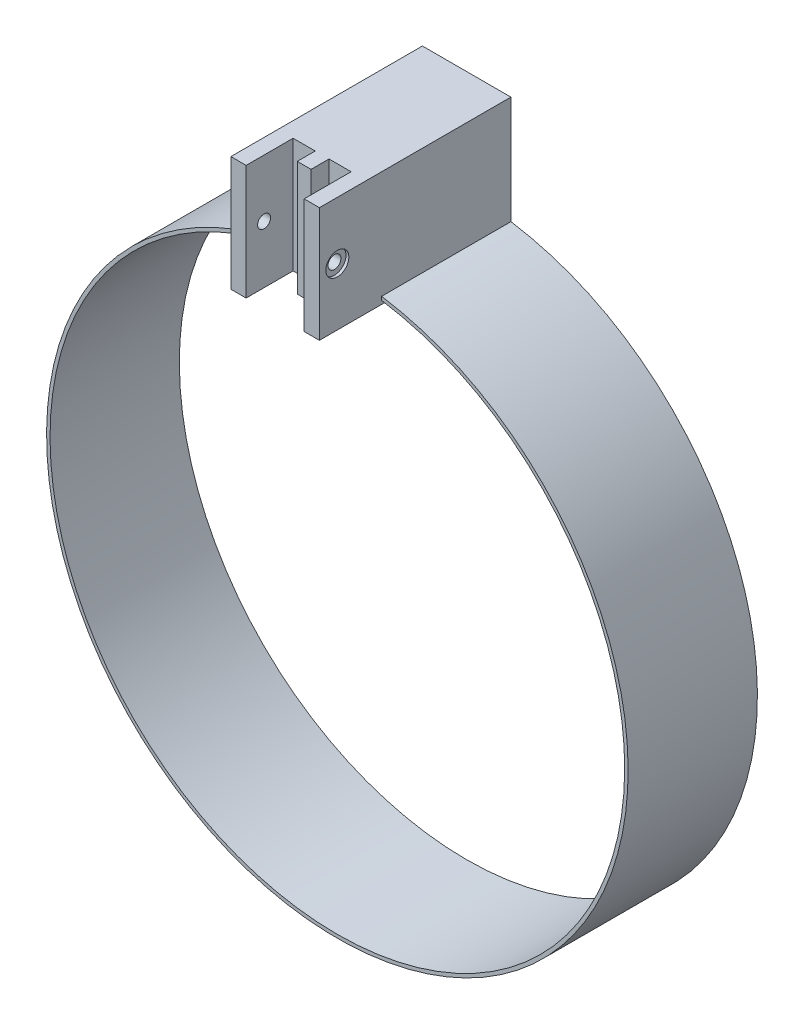
from build123d import *

# Parameters (mm, degrees)
BOSS_EXTRU_1_DEPTH                                = 20
CHAMBRAGE_POUR_VIS_SIX_PANS_CREUX_M41_D           = 4.5
CHAMBRAGE_POUR_VIS_SIX_PANS_CREUX_M41_DEPTH       = 11.55
CHAMBRAGE_POUR_VIS_SIX_PANS_CREUX_M41_CBORE_D     = 8
CHAMBRAGE_POUR_VIS_SIX_PANS_CREUX_M41_CBORE_DEPTH = 1
ESQUISSE6_W                                       = 20.2
ESQUISSE6_H                                       = 40
ENL_V_MAT_EXTRU_1_DEPTH                           = 3
ESQUISSE16_R                                      = 101.2
ESQUISSE16_R_2                                    = 100
EXTRU_MINCE1_DEPTH                                = 45
ESQUISSE14_W                                      = 30.8
ESQUISSE14_H                                      = 45
BOSS_EXTRU_3_DEPTH                                = 40


with BuildPart() as part:
    # Base → Boss.-Extru.1 (new, symmetric)
    with BuildSketch(Plane(origin=(0, 0, 0), x_dir=(1, 0, 0), z_dir=(0, 1, 0))):
        Polygon((-3.85, -2.4), (-3.85, 2.4), (-10.1, 2.4), (-10.1, 10.1), (-2.4, 10.1), (-2.4, 3.85), (2.4, 3.85), (2.4, 10.1), (10.1, 10.1), (10.1, 2.4), (3.85, 2.4), (3.85, -2.4), (10.1, -2.4), (10.1, -6.25), (15.4, -6.25), (15.4, 15.4), (-15.4, 15.4), (-15.4, -6.25), (-10.1, -6.25), (-10.1, -2.4), align=None)
    extrude(amount=BOSS_EXTRU_1_DEPTH, both=True)

    # Chambrage pour vis à six pans creux M41
    with Locations(Plane(origin=(15.4, 0, 0), x_dir=(0, 0, -1), z_dir=(1, 0, 0))):
        with Locations((0, 0)):
            chambrage_pour_vis_six_pans_creux_m41 = CounterBoreHole(CHAMBRAGE_POUR_VIS_SIX_PANS_CREUX_M41_D / 2, CHAMBRAGE_POUR_VIS_SIX_PANS_CREUX_M41_CBORE_D / 2, CHAMBRAGE_POUR_VIS_SIX_PANS_CREUX_M41_CBORE_DEPTH, depth=CHAMBRAGE_POUR_VIS_SIX_PANS_CREUX_M41_DEPTH)

    # Symétrie1: Chambrage pour vis à six pans creux M41 across plane
    add(chambrage_pour_vis_six_pans_creux_m41.mirror(Plane(origin=(0, 0, 0), x_dir=(0, 0, 1), z_dir=(1, 0, 0))), mode=Mode.SUBTRACT)

    # Esquisse6 → Enlèv. mat.-Extru.1 (cut, symmetric)
    with BuildSketch(Plane.XY):
        Rectangle(ESQUISSE6_W, ESQUISSE6_H)
    extrude(amount=ENL_V_MAT_EXTRU_1_DEPTH, both=True, mode=Mode.SUBTRACT)

    # Esquisse16 → Extru.-Mince1 (add)
    with BuildSketch(Plane(origin=(0, 0, -15.4), x_dir=(-1, 0, 0), z_dir=(0, 0, -1))):
        with Locations((0, -117.566500624)):
            Circle(ESQUISSE16_R)
        with Locations((0, -117.566500624)):
            Circle(ESQUISSE16_R_2, mode=Mode.SUBTRACT)
    extrude(amount=EXTRU_MINCE1_DEPTH)

    # Esquisse14 → Boss.-Extru.3 (add)
    with BuildSketch(Plane.XZ.offset(20)):
        with Locations((0, -37.9)):
            Rectangle(ESQUISSE14_W, ESQUISSE14_H)
    extrude(amount=-BOSS_EXTRU_3_DEPTH)


solid = part.part
